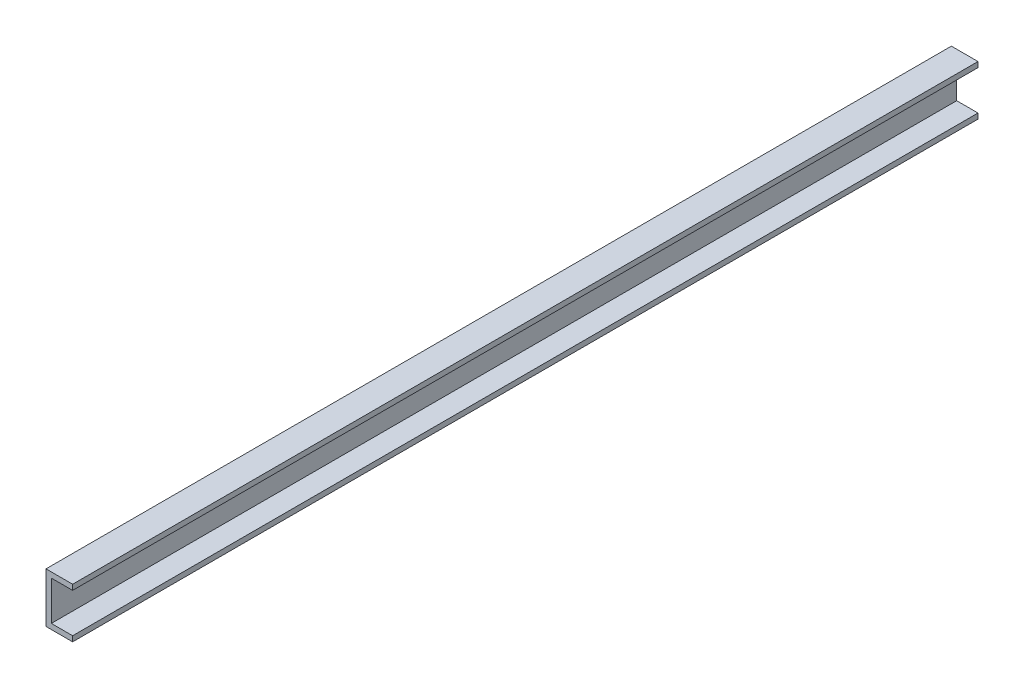
from build123d import *

# Parameters (mm, degrees)
BOSS_EXTRUDE1_DEPTH = 1360


with BuildPart() as part:
    # Sketch1 → Boss-Extrude1 (new body)
    with BuildSketch(Plane.XY):
        Polygon((0, 0), (0, 75), (40, 75), (40, 67), (8, 67), (8, 8), (40, 8), (40, 0), align=None)
    extrude(amount=BOSS_EXTRUDE1_DEPTH)


solid = part.part
